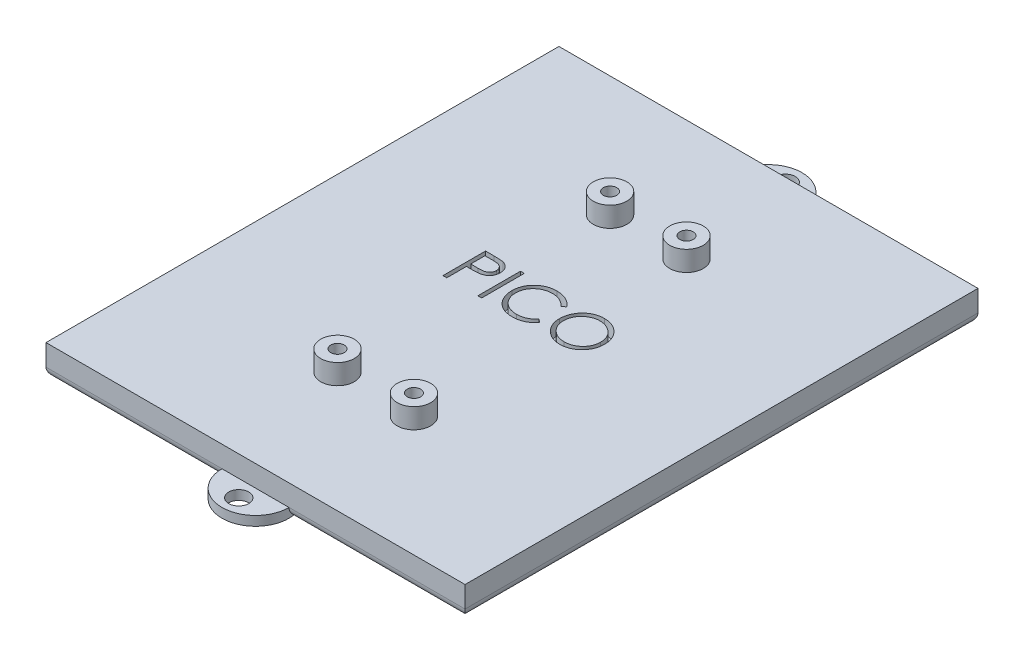
from build123d import *

# Parameters (mm, degrees)
SKETCH1_W           = 62.5
SKETCH1_H           = 76.5
BOSS_EXTRUDE1_DEPTH = 4.575
SKETCH4_R           = 1.5
BOSS_EXTRUDE3_DEPTH = 1.4
FILLET1_R           = 1.4
SKETCH2_R           = 2.5
SKETCH2_R_2         = 1
SCREW_HOLES_DEPTH   = 3
CUT_EXTRUDE1_START  = -3.575
SKETCH3_R           = 1
CUT_EXTRUDE1_DEPTH  = 3.575
SKETCH5_W           = 0.569871795
SKETCH5_H           = 6.35
LETTERS_DEPTH       = 2


with BuildPart() as part:
    # Sketch1 → Boss-Extrude1 (new body)
    with BuildSketch(Plane(origin=(0, 0, 0), x_dir=(1, 0, 0), z_dir=(0, 1, 0))):
        Rectangle(SKETCH1_W, SKETCH1_H)
    extrude(amount=BOSS_EXTRUDE1_DEPTH)

    # Sketch4 → Boss-Extrude3 (add)
    with BuildSketch(Plane(origin=(0, 0, 0), x_dir=(1, 0, 0), z_dir=(0, 1, 0))):
        with BuildLine():
            Line((-5, -38.25), (5, -38.25))
            ThreePointArc((5, -38.25), (0, -43.25), (-5, -38.25))
        make_face()
        with Locations(Location((0, -40.75, 0), (0, 0, 270))):
            Circle(SKETCH4_R, mode=Mode.SUBTRACT)
    boss_extrude3 = extrude(amount=BOSS_EXTRUDE3_DEPTH)

    # Mirror1: Boss-Extrude3 across plane
    add(boss_extrude3.mirror(Plane.XY))

    # Fillet1
    fillet1_edges = [part.edges().sort_by_distance(p)[0] for p in [
        (-18.125, 0, 38.25),
        (18.125, 0, 38.25),
        (31.25, 0, 0),
        (18.125, 0, -38.25),
        (-18.125, 0, -38.25),
        (-31.25, 0, 0),
    ]]
    fillet(fillet1_edges, radius=FILLET1_R)

    # Sketch2 → Screw_Holes (add)
    # profile 1 of 4: a face of its own
    with BuildSketch(Plane(origin=(0, 4.575, 0), x_dir=(1, 0, 0), z_dir=(0, 1, 0))):
        with Locations(Location((-5.7, -20.3255, 0), (0, 0, 270))):
            Circle(SKETCH2_R)
        with Locations(Location((-5.7, -20.3255, 0), (0, 0, 270))):
            Circle(SKETCH2_R_2, mode=Mode.SUBTRACT)
    # profile 2 of 4: a face of its own
    with BuildSketch(Plane(origin=(0, 4.575, 0), x_dir=(1, 0, 0), z_dir=(0, 1, 0))):
        with Locations(Location((5.7, -20.3255, 0), (0, 0, 270))):
            Circle(SKETCH2_R)
        with Locations(Location((5.7, -20.3255, 0), (0, 0, 270))):
            Circle(SKETCH2_R_2, mode=Mode.SUBTRACT)
    # profile 3 of 4: a face of its own
    with BuildSketch(Plane(origin=(0, 4.575, 0), x_dir=(1, 0, 0), z_dir=(0, 1, 0))):
        with Locations(Location((5.7, 20.3255, 0), (0, 0, 270))):
            Circle(SKETCH2_R)
        with Locations(Location((5.7, 20.3255, 0), (0, 0, 270))):
            Circle(SKETCH2_R_2, mode=Mode.SUBTRACT)
    # profile 4 of 4: a face of its own
    with BuildSketch(Plane(origin=(0, 4.575, 0), x_dir=(1, 0, 0), z_dir=(0, 1, 0))):
        with Locations(Location((-5.7, 20.3255, 0), (0, 0, 270))):
            Circle(SKETCH2_R)
        with Locations(Location((-5.7, 20.3255, 0), (0, 0, 270))):
            Circle(SKETCH2_R_2, mode=Mode.SUBTRACT)
    extrude(amount=SCREW_HOLES_DEPTH)

    # Sketch3 → Cut-Extrude1 (cut)
    with BuildSketch(Plane(origin=(0, 4.575, 0), x_dir=(1, 0, 0), z_dir=(0, 1, 0)).offset(CUT_EXTRUDE1_START)):
        with Locations(Location((5.7, -20.3255, 0), (0, 0, 270))):
            Circle(SKETCH3_R)
        with Locations(Location((-5.7, -20.3255, 0), (0, 0, 270))):
            Circle(SKETCH3_R)
        with Locations(Location((-5.7, 20.3255, 0), (0, 0, 270))):
            Circle(SKETCH3_R)
        with Locations(Location((5.7, 20.3255, 0), (0, 0, 270))):
            Circle(SKETCH3_R)
    extrude(amount=CUT_EXTRUDE1_DEPTH, mode=Mode.SUBTRACT)

    # Sketch5 → Letters (cut)
    # profile 1 of 4: a face of its own
    with BuildSketch(Plane(origin=(0, 4.575, 0), x_dir=(1, 0, 0), z_dir=(0, 1, 0))):
        with BuildLine():
            Line((-10.298397436, 6.35), (-9.05307492, 6.35))
            add(Edge.make_bspline(
                [(-9.05307492, 6.35), (-8.967420847, 6.349905845), (-8.80330384, 6.349725441), (-8.567963668, 6.344255831), (-8.354223155, 6.336950261), (-8.162543178, 6.326823112), (-7.992333971, 6.314855012), (-7.844365728, 6.298069169), (-7.71747539, 6.280542633), (-7.641445117, 6.262723796), (-7.606770833, 6.254597356)],
                knots=[0, 0, 0, 0, 1.415646017, 2.712440637, 3.8905458, 4.950247383, 5.884950622, 6.709939814, 7.411656543, 8, 8, 8, 8], degree=3))
            add(Edge.make_bspline(
                [(-7.606770833, 6.254597356), (-7.562876851, 6.242583247), (-7.476123192, 6.218838126), (-7.351117014, 6.171278942), (-7.232183608, 6.114887014), (-7.118914924, 6.050617866), (-7.012702859, 5.975714057), (-6.911962756, 5.893211922), (-6.817583649, 5.801206647), (-6.730096266, 5.700730162), (-6.649750991, 5.59346921), (-6.580572852, 5.477822593), (-6.52264774, 5.355736942), (-6.472966662, 5.227297177), (-6.437209895, 5.091424733), (-6.410273376, 4.949063698), (-6.393176224, 4.800229332), (-6.391538719, 4.698520715), (-6.390705128, 4.646744792)],
                knots=[0, 0, 0, 0, 0.999701418, 1.975846123, 2.934577507, 3.890451536, 4.834027766, 5.787354733, 6.749476667, 7.726910423, 8.712836071, 9.690891519, 10.682875813, 11.679750201, 12.712814741, 13.765529915, 14.8625177, 16, 16, 16, 16], degree=3))
            add(Edge.make_bspline(
                [(-6.390705128, 4.646744792), (-6.391469713, 4.594533682), (-6.392965675, 4.492379121), (-6.410920364, 4.342931348), (-6.43510514, 4.200113697), (-6.47229265, 4.064242837), (-6.520998371, 3.936125653), (-6.578133952, 3.813804275), (-6.647046929, 3.699359728), (-6.72623112, 3.592376529), (-6.814317584, 3.492754259), (-6.910933629, 3.401214846), (-7.015689202, 3.318294118), (-7.128251385, 3.24380618), (-7.24971754, 3.179478359), (-7.378245447, 3.121861534), (-7.514952268, 3.07347261), (-7.609553686, 3.04801807), (-7.657652244, 3.035076122)],
                knots=[0, 0, 0, 0, 1.121902311, 2.195077645, 3.232258892, 4.234102512, 5.217864754, 6.176164875, 7.132989551, 8.084763148, 9.034132444, 9.988522005, 10.94243251, 11.903244335, 12.886203696, 13.894208494, 14.929344452, 16, 16, 16, 16], degree=3))
            add(Edge.make_bspline(
                [(-7.657652244, 3.035076122), (-7.697434692, 3.026616142), (-7.784620242, 3.008075604), (-7.928207752, 2.987377404), (-8.09538581, 2.969710614), (-8.285926232, 2.956464264), (-8.499657988, 2.94512431), (-8.736696698, 2.936110768), (-8.997507666, 2.931158033), (-9.179428352, 2.930902595), (-9.274409054, 2.930769231)],
                knots=[0, 0, 0, 0, 0.601384939, 1.31797006, 2.144135048, 3.087295005, 4.142315834, 5.309527816, 6.595305764, 8, 8, 8, 8], degree=3))
            Line((-9.274409054, 2.930769231), (-9.728525641, 2.930769231))
            Line((-9.728525641, 2.930769231), (-9.728525641, 0))
            Line((-9.728525641, 0), (-10.298397436, 0))
            Line((-10.298397436, 0), (-10.298397436, 6.35))
        make_face()
        with BuildLine():
            Line((-9.728525641, 5.698717949), (-9.728525641, 3.582051282))
            Line((-9.728525641, 3.582051282), (-8.616766827, 3.568058894))
            add(Edge.make_bspline(
                [(-8.616766827, 3.568058894), (-8.562483533, 3.568030839), (-8.457690753, 3.567976679), (-8.306313605, 3.575207013), (-8.165871041, 3.583553693), (-8.036794454, 3.595774583), (-7.919025659, 3.613048864), (-7.812368285, 3.630487303), (-7.717649358, 3.655715604), (-7.606797949, 3.689684601), (-7.483275304, 3.747619489), (-7.348895609, 3.831711433), (-7.235011831, 3.938900717), (-7.136462921, 4.059419783), (-7.058256542, 4.193493918), (-7.001004956, 4.33694756), (-6.967365999, 4.488309516), (-6.962855334, 4.59188371), (-6.960576923, 4.644200721)],
                knots=[0, 0, 0, 0, 1.160613943, 2.240541288, 3.23993089, 4.169200891, 5.011653406, 5.7853311, 6.478053781, 7.106038997, 8.262395093, 9.384106736, 10.481365981, 11.59014053, 12.70357646, 13.786202915, 14.881775077, 16, 16, 16, 16], degree=3))
            add(Edge.make_bspline(
                [(-6.960576923, 4.644200721), (-6.962867725, 4.695252024), (-6.967421554, 4.796735696), (-7.00126862, 4.94546859), (-7.058145233, 5.087410511), (-7.136987911, 5.219804537), (-7.23267539, 5.339889939), (-7.343889913, 5.444206155), (-7.470369687, 5.52806553), (-7.588022906, 5.582191627), (-7.692527915, 5.615239341), (-7.783300185, 5.638362123), (-7.885790409, 5.65682358), (-8.000031951, 5.671772392), (-8.12513935, 5.684569386), (-8.262187436, 5.693252516), (-8.410657045, 5.698335158), (-8.513727653, 5.698587263), (-8.567157452, 5.698717949)],
                knots=[0, 0, 0, 0, 1.120700087, 2.227813068, 3.331159281, 4.466773991, 5.599788987, 6.693661531, 7.80175334, 8.91857717, 9.525282508, 10.207424825, 10.974604443, 11.810962634, 12.737642355, 13.736264703, 14.826523623, 16, 16, 16, 16], degree=3))
            Line((-8.567157452, 5.698717949), (-9.728525641, 5.698717949))
        make_face(mode=Mode.SUBTRACT)
    # profile 2 of 4: a face of its own
    with BuildSketch(Plane(origin=(0, 4.575, 0), x_dir=(1, 0, 0), z_dir=(0, 1, 0))):
        with Locations((-4.803205129, 3.175)):
            Rectangle(SKETCH5_W, SKETCH5_H)
    # profile 3 of 4: a face of its own
    with BuildSketch(Plane(origin=(0, 4.575, 0), x_dir=(1, 0, 0), z_dir=(0, 1, 0))):
        with BuildLine():
            Line((2.971474359, 5.184815705), (2.472836538, 4.803205128))
            add(Edge.make_bspline(
                [(2.472836538, 4.803205128), (2.437265855, 4.845597673), (2.366604059, 4.929811221), (2.252922363, 5.048065537), (2.134446525, 5.158855368), (2.011221834, 5.262708493), (1.881030288, 5.355993196), (1.747025697, 5.443570769), (1.606966386, 5.522070808), (1.413288239, 5.617253654), (1.159927143, 5.716578821), (0.840985077, 5.799860398), (0.508043513, 5.852875959), (0.280899297, 5.858617886), (0.165364583, 5.861538462)],
                knots=[0, 0, 0, 0, 0.757959112, 1.505699292, 2.245454638, 2.979532153, 3.711538275, 4.438200793, 5.171680507, 5.909471876, 7.393775596, 8.890124382, 10.418191784, 12, 12, 12, 12], degree=3))
            add(Edge.make_bspline(
                [(0.165364583, 5.861538462), (0.101713455, 5.860805558), (-0.024998061, 5.859346553), (-0.213046005, 5.840098569), (-0.397582541, 5.813045374), (-0.57848763, 5.772903716), (-0.755530997, 5.722153393), (-0.92987007, 5.661510142), (-1.098980729, 5.586480646), (-1.26520239, 5.503552803), (-1.424458959, 5.409885868), (-1.575144545, 5.307717358), (-1.716709573, 5.198190569), (-1.849266026, 5.08089499), (-1.972949418, 4.956358862), (-2.086863539, 4.823254985), (-2.190614212, 4.682008899), (-2.286257958, 4.534483145), (-2.371915345, 4.381107437), (-2.443633841, 4.221314095), (-2.507143134, 4.057839508), (-2.557397474, 3.888836688), (-2.597174812, 3.715494813), (-2.624620715, 3.537348669), (-2.643649799, 3.354770422), (-2.645101548, 3.23101924), (-2.645833333, 3.168639824)],
                knots=[0, 0, 0, 0, 1.054917814, 2.100044995, 3.131103042, 4.146048494, 5.169673617, 6.183595914, 7.203665975, 8.234915748, 9.262203917, 10.264457458, 11.251630812, 12.227803204, 13.197192746, 14.159520551, 15.12972552, 16.100847026, 17.073214652, 18.039054194, 19.002613845, 19.979014051, 20.95965708, 21.949030935, 22.966165397, 24, 24, 24, 24], degree=3))
            add(Edge.make_bspline(
                [(-2.645833333, 3.168639824), (-2.643544033, 3.074784429), (-2.639049296, 2.890511811), (-2.599047318, 2.620599417), (-2.53825951, 2.362026195), (-2.447154106, 2.116408481), (-2.334815257, 1.880717603), (-2.192864433, 1.658941397), (-2.028460144, 1.447728487), (-1.839276554, 1.252070568), (-1.631711717, 1.073338524), (-1.409011934, 0.915948183), (-1.171731869, 0.784748325), (-0.922491412, 0.675571964), (-0.659372605, 0.591649044), (-0.382848606, 0.53256842), (-0.093520844, 0.494029036), (0.104180782, 0.490339344), (0.204797676, 0.488461538)],
                knots=[0, 0, 0, 0, 1.029171465, 2.020641659, 2.987623507, 3.938342917, 4.889210282, 5.84687017, 6.821220943, 7.821438502, 8.827599549, 9.822697543, 10.807740252, 11.797342354, 12.80366471, 13.83203677, 14.896651826, 16, 16, 16, 16], degree=3))
            add(Edge.make_bspline(
                [(0.204797676, 0.488461538), (0.315655412, 0.491525467), (0.533849955, 0.497556013), (0.853831946, 0.548644936), (1.160148264, 0.631481444), (1.452815385, 0.747410532), (1.731008243, 0.898114697), (1.995162184, 1.080809417), (2.245500176, 1.297232535), (2.396033788, 1.462483354), (2.472836538, 1.546794872)],
                knots=[0, 0, 0, 0, 1.028121516, 2.023589091, 2.998037872, 3.967518031, 4.937445131, 5.927275754, 6.942489185, 8, 8, 8, 8], degree=3))
            Line((2.472836538, 1.546794872), (2.971474359, 1.169000401))
            add(Edge.make_bspline(
                [(2.971474359, 1.169000401), (2.931345788, 1.117223495), (2.85128086, 1.013917692), (2.721635601, 0.868281876), (2.585061076, 0.731295983), (2.440542859, 0.604064442), (2.289743437, 0.48404134), (2.129955099, 0.374636589), (1.963278426, 0.274323127), (1.790278157, 0.182471421), (1.611138102, 0.100978702), (1.426072913, 0.03121258), (1.235880297, -0.028885434), (1.040551561, -0.078328233), (0.839681545, -0.116920057), (0.633995113, -0.14271861), (0.42304834, -0.160393226), (0.28073319, -0.162004159), (0.208613782, -0.162820513)],
                knots=[0, 0, 0, 0, 0.986787822, 1.968848986, 2.935600012, 3.899624008, 4.868462664, 5.837806735, 6.815139263, 7.798259679, 8.787526145, 9.778297419, 10.776456485, 11.791383307, 12.812564526, 13.85620153, 14.913611965, 16, 16, 16, 16], degree=3))
            add(Edge.make_bspline(
                [(0.208613782, -0.162820513), (0.140317415, -0.162345183), (0.005269805, -0.161405279), (-0.19411793, -0.146179489), (-0.388227598, -0.125406395), (-0.576504419, -0.094127871), (-0.759975831, -0.057217426), (-0.936978605, -0.007739575), (-1.109254487, 0.047685342), (-1.276111334, 0.112827246), (-1.437691075, 0.186335178), (-1.593472561, 0.269414149), (-1.743384146, 0.361365532), (-1.888899695, 0.460162479), (-2.027869597, 0.568978441), (-2.161498136, 0.686302192), (-2.290534628, 0.811738298), (-2.370368071, 0.902189246), (-2.410506811, 0.947666266)],
                knots=[0, 0, 0, 0, 1.114604814, 2.203992996, 3.262667896, 4.300477797, 5.318619304, 6.316056647, 7.298880507, 8.271930387, 9.238335007, 10.195173496, 11.151986948, 12.108099108, 13.064862484, 14.031167946, 15.010108607, 16, 16, 16, 16], degree=3))
            add(Edge.make_bspline(
                [(-2.410506811, 0.947666266), (-2.474797193, 1.026662423), (-2.602601786, 1.183701026), (-2.766115527, 1.438219878), (-2.906083234, 1.703955057), (-3.019250976, 1.982302642), (-3.107720506, 2.272638045), (-3.169009246, 2.575107621), (-3.208835728, 2.889428887), (-3.213390109, 3.10321849), (-3.215705128, 3.211889022)],
                knots=[0, 0, 0, 0, 0.994628077, 1.977248131, 2.950237994, 3.925870899, 4.908910175, 5.911660606, 6.938484602, 8, 8, 8, 8], degree=3))
            add(Edge.make_bspline(
                [(-3.215705128, 3.211889022), (-3.212883563, 3.326108202), (-3.207332309, 3.550827308), (-3.160168509, 3.880617195), (-3.084297264, 4.19657759), (-2.976534338, 4.49811867), (-2.839908914, 4.786826464), (-2.671132058, 5.060495507), (-2.472164528, 5.320875986), (-2.244566799, 5.564017035), (-1.994980347, 5.786338432), (-1.727701928, 5.981929687), (-1.443254681, 6.144702895), (-1.144772293, 6.280767361), (-0.830019699, 6.385350887), (-0.499668444, 6.458563097), (-0.15433927, 6.504132722), (0.081268274, 6.509893457), (0.200981571, 6.512820513)],
                knots=[0, 0, 0, 0, 1.032925535, 2.032216505, 3.007276963, 3.968222605, 4.92396291, 5.891752235, 6.871517503, 7.883894988, 8.900124299, 9.891468569, 10.874487609, 11.85992873, 12.854644235, 13.869047385, 14.917252991, 16, 16, 16, 16], degree=3))
            add(Edge.make_bspline(
                [(0.200981571, 6.512820513), (0.273942112, 6.511945776), (0.418360158, 6.510214324), (0.631997113, 6.493330323), (0.839991049, 6.465184209), (1.042485259, 6.426873625), (1.240464863, 6.379326056), (1.432416728, 6.317385801), (1.619467203, 6.246562379), (1.800436594, 6.164994877), (1.97445662, 6.073433789), (2.141473084, 5.972894015), (2.300159327, 5.863500196), (2.451631952, 5.746182721), (2.593357078, 5.61845962), (2.729358618, 5.483843982), (2.855018003, 5.33845833), (2.932584513, 5.236123664), (2.971474359, 5.184815705)],
                knots=[0, 0, 0, 0, 1.096760587, 2.17092713, 3.219439832, 4.250915756, 5.268269357, 6.278326846, 7.281116186, 8.274029601, 9.260640565, 10.235837813, 11.203064059, 12.156899882, 13.114053108, 14.069676657, 15.032185724, 16, 16, 16, 16], degree=3))
        make_face()
    # profile 4 of 4: a face of its own
    with BuildSketch(Plane(origin=(0, 4.575, 0), x_dir=(1, 0, 0), z_dir=(0, 1, 0))):
        with BuildLine():
            add(Edge.make_bspline(
                [(7.245512821, 6.512820513), (7.363093241, 6.5098424), (7.594030888, 6.503993141), (7.933438203, 6.459218196), (8.257460733, 6.38175656), (8.568737985, 6.278590864), (8.863546671, 6.140969336), (9.144105804, 5.974626281), (9.409747847, 5.777818991), (9.656892353, 5.552068823), (9.883055677, 5.306444556), (10.082311214, 5.044320348), (10.249302233, 4.767281093), (10.386436446, 4.4761593), (10.494021067, 4.171613358), (10.568259903, 3.852019667), (10.615681976, 3.519448958), (10.621226029, 3.292614503), (10.624038462, 3.177544071)],
                knots=[0, 0, 0, 0, 1.065120563, 2.091984664, 3.0946048, 4.079830382, 5.057816894, 6.036188127, 7.030412546, 8.04752943, 9.064399622, 10.05169764, 11.02544977, 11.989514704, 12.962713494, 13.945757189, 14.957906945, 16, 16, 16, 16], degree=3))
            add(Edge.make_bspline(
                [(10.624038462, 3.177544071), (10.621226441, 3.063321275), (10.615683623, 2.838174912), (10.568205984, 2.507714663), (10.493745884, 2.190050114), (10.387435515, 1.885711573), (10.250955004, 1.594377993), (10.082852051, 1.316815948), (9.884838711, 1.052934444), (9.659491996, 0.805624322), (9.41383582, 0.578843197), (9.150346621, 0.381233237), (8.87495017, 0.211190896), (8.584102556, 0.075511945), (8.281661061, -0.032931396), (7.964918846, -0.106868311), (7.635360098, -0.154560518), (7.410622705, -0.160036968), (7.296394231, -0.162820513)],
                knots=[0, 0, 0, 0, 1.043624062, 2.057103931, 3.04512605, 4.022047818, 4.998200453, 5.980619268, 6.982898556, 8.009068085, 9.034988726, 10.034168286, 11.015286542, 11.987931943, 12.962482838, 13.94673481, 14.956375938, 16, 16, 16, 16], degree=3))
            add(Edge.make_bspline(
                [(7.296394231, -0.162820513), (7.181324395, -0.160009482), (6.954491117, -0.154468193), (6.621502496, -0.106967644), (6.301684304, -0.032688422), (5.995951124, 0.073464412), (5.704132466, 0.210655674), (5.425657601, 0.377940762), (5.161644291, 0.576436575), (4.914281408, 0.801710217), (4.68795072, 1.046950033), (4.490630139, 1.309720753), (4.323307433, 1.584867082), (4.186576816, 1.87315259), (4.078328439, 2.173183636), (4.004478269, 2.486961588), (3.956697328, 2.812697548), (3.951191249, 3.034481092), (3.948397436, 3.147015224)],
                knots=[0, 0, 0, 0, 1.053102029, 2.075944431, 3.073151272, 4.055350789, 5.033113405, 6.020478099, 7.024410459, 8.052272461, 9.079885166, 10.07527673, 11.055994387, 12.023226415, 12.992069828, 13.970394897, 14.97016774, 16, 16, 16, 16], degree=3))
            add(Edge.make_bspline(
                [(3.948397436, 3.147015224), (3.949367417, 3.222548781), (3.951295144, 3.372663005), (3.974502929, 3.595578123), (4.008179158, 3.814908316), (4.056442628, 4.030029893), (4.119564652, 4.240416251), (4.194044759, 4.447518349), (4.285012764, 4.649237391), (4.387847654, 4.846528973), (4.502622649, 5.036317602), (4.629397223, 5.215713417), (4.763718534, 5.386221797), (4.91097212, 5.543424219), (5.066304813, 5.691893852), (5.232236442, 5.829349067), (5.407754514, 5.957029336), (5.59361426, 6.072091954), (5.785235988, 6.176157813), (5.98276957, 6.265460314), (6.183532207, 6.34210674), (6.388464211, 6.40422938), (6.597021383, 6.453273217), (6.809658907, 6.486669416), (7.02620738, 6.509936392), (7.172096487, 6.511855003), (7.245512821, 6.512820513)],
                knots=[0, 0, 0, 0, 1.037015668, 2.060948919, 3.074880161, 4.083647147, 5.086022904, 6.090072063, 7.104153813, 8.122640571, 9.144368836, 10.147691507, 11.138137339, 12.123020368, 13.103399296, 14.087645067, 15.080126199, 16.082011238, 17.087798457, 18.072939717, 19.057185487, 20.037253025, 21.01195951, 21.997135196, 22.992090687, 24, 24, 24, 24], degree=3))
        make_face()
        with BuildLine():
            add(Edge.make_bspline(
                [(7.273497596, 5.861538462), (7.213236761, 5.860803875), (7.093291188, 5.859341724), (6.914974958, 5.840081783), (6.739003878, 5.812631842), (6.565341607, 5.773476797), (6.394714768, 5.720129444), (6.225532913, 5.658732368), (6.059338801, 5.583945532), (5.896681087, 5.49944934), (5.738992308, 5.405924869), (5.590197836, 5.302561806), (5.449912467, 5.191784144), (5.318479684, 5.073333353), (5.196285414, 4.946606218), (5.080924599, 4.813523941), (4.977021215, 4.670282653), (4.881797382, 4.520766629), (4.796584301, 4.365170618), (4.720810014, 4.205132725), (4.658826741, 4.039347493), (4.60827643, 3.869613521), (4.566366773, 3.69619963), (4.539816654, 3.517790305), (4.520345087, 3.33528203), (4.518966511, 3.211943523), (4.518269231, 3.149559295)],
                knots=[0, 0, 0, 0, 1.008559885, 2.007477868, 2.99961109, 3.989939068, 4.984837346, 5.991145699, 7.001802488, 8.033829008, 9.059044045, 10.069351652, 11.065060232, 12.050310815, 13.029377138, 14.011219647, 14.996725999, 15.989392538, 16.977580475, 17.965360261, 18.951710183, 19.937753436, 20.929683414, 21.935841486, 22.955955122, 24, 24, 24, 24], degree=3))
            add(Edge.make_bspline(
                [(4.518269231, 3.149559295), (4.520582195, 3.05782498), (4.52513251, 2.877355204), (4.564969816, 2.612890143), (4.626332541, 2.358729966), (4.716788049, 2.116265359), (4.829909878, 1.88341216), (4.969658665, 1.662236027), (5.13522872, 1.452677184), (5.323303975, 1.256198625), (5.528903743, 1.076864094), (5.747221696, 0.919450481), (5.975918955, 0.786263314), (6.215591909, 0.677759825), (6.464961015, 0.591781301), (6.725633143, 0.532855784), (6.995871834, 0.494074601), (7.180077452, 0.490350315), (7.273497596, 0.488461538)],
                knots=[0, 0, 0, 0, 1.032063989, 2.030389145, 3.003944642, 3.970395727, 4.937377036, 5.913328081, 6.909231446, 7.93887556, 8.970685674, 9.976071282, 10.964166581, 11.944589148, 12.933237628, 13.927779006, 14.949070134, 16, 16, 16, 16], degree=3))
            add(Edge.make_bspline(
                [(7.273497596, 0.488461538), (7.336289121, 0.489324239), (7.460823572, 0.491035234), (7.64605402, 0.508268548), (7.827947433, 0.535903511), (8.006248683, 0.575691986), (8.180755412, 0.62548906), (8.352195984, 0.684648795), (8.518744311, 0.758456122), (8.682501445, 0.840004549), (8.839248912, 0.932968834), (8.988883092, 1.032823763), (9.12763237, 1.143438261), (9.258966828, 1.260129149), (9.381662778, 1.385249273), (9.494890506, 1.518635961), (9.598268746, 1.661131154), (9.693456419, 1.81042039), (9.77837091, 1.966442163), (9.852355847, 2.127060293), (9.915123086, 2.291879277), (9.965793373, 2.461136842), (10.005499854, 2.634511525), (10.032859137, 2.812235467), (10.051997018, 2.993953131), (10.053439516, 3.116859841), (10.054166667, 3.178816106)],
                knots=[0, 0, 0, 0, 1.047197238, 2.076906641, 3.100256066, 4.114471768, 5.12198147, 6.126382909, 7.136867548, 8.15857795, 9.17633901, 10.174870724, 11.156907918, 12.133735059, 13.104061851, 14.077631395, 15.04955518, 16.038496417, 17.029181396, 18.010275684, 18.986308667, 19.968651475, 20.955262928, 21.950658345, 22.966943676, 24, 24, 24, 24], degree=3))
            add(Edge.make_bspline(
                [(10.054166667, 3.178816106), (10.053438933, 3.240348521), (10.05199534, 3.3624094), (10.032868278, 3.542859742), (10.005470949, 3.719304854), (9.965987179, 3.89105204), (9.915096185, 4.058145078), (9.852344886, 4.220427035), (9.7783487, 4.378502474), (9.693425207, 4.531980699), (9.59796507, 4.679254866), (9.493654086, 4.820047815), (9.37869124, 4.951715503), (9.256361166, 5.077508448), (9.123608274, 5.194743762), (8.981033912, 5.303460335), (8.830368954, 5.406281847), (8.670843827, 5.499038223), (8.506208368, 5.584698331), (8.337273044, 5.658088008), (8.165951678, 5.720448853), (7.992679931, 5.773638204), (7.815999384, 5.812478488), (7.637103866, 5.840106521), (7.456240883, 5.859335021), (7.334605327, 5.860801651), (7.273497596, 5.861538462)],
                knots=[0, 0, 0, 0, 1.02996197, 2.043119294, 3.035359645, 4.018872909, 4.991431989, 5.957985074, 6.929999688, 7.912076566, 8.892894881, 9.867085534, 10.843653904, 11.817741046, 12.803660682, 13.806313499, 14.818574707, 15.856120519, 16.894564902, 17.924820532, 18.937903209, 19.946497019, 20.957711757, 21.963978472, 22.977135795, 24, 24, 24, 24], degree=3))
        make_face(mode=Mode.SUBTRACT)
    extrude(amount=-LETTERS_DEPTH, mode=Mode.SUBTRACT)


solid = part.part
